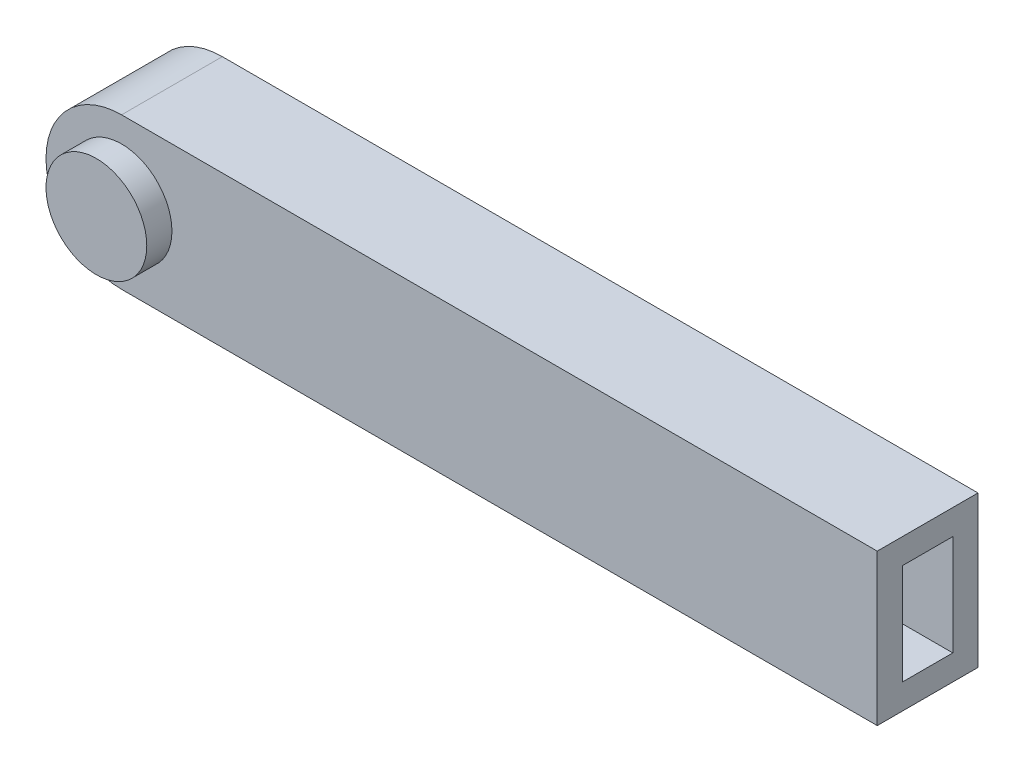
from build123d import *

# Parameters (mm, degrees)
BOSS_EXTRUDE1_DEPTH = 40
SHELL1_T            = -10
BOSS_EXTRUDE2_START = 10
SKETCH1_3_R         = 20
BOSS_EXTRUDE2_DEPTH = 10
SKETCH2_R           = 20
BOSS_EXTRUDE3_DEPTH = 10


with BuildPart() as part:
    # Sketch1 → Boss-Extrude1 (new body)
    with BuildSketch(Plane.XY):
        with BuildLine():
            Line((-300, 0), (0, 0))
            Line((0, 0), (0, 60))
            Line((0, 60), (-300, 60))
            ThreePointArc((-300, 60), (-330, 30), (-300, 0))
        make_face()
    extrude(amount=-BOSS_EXTRUDE1_DEPTH)

    # Shell1
    shell1_openings = [part.faces().sort_by_distance(p)[0] for p in [
        (0, 30, -20),
    ]]
    offset(amount=SHELL1_T, openings=shell1_openings, kind=Kind.INTERSECTION)

    # Sketch1<3> → Boss-Extrude2 (add)
    with BuildSketch(Plane.XY.offset(BOSS_EXTRUDE2_START)):
        with Locations((-300, 30)):
            Circle(SKETCH1_3_R)
    extrude(amount=-BOSS_EXTRUDE2_DEPTH)

    # Sketch2 → Boss-Extrude3 (add)
    with BuildSketch(Plane(origin=(0, 0, -40), x_dir=(-1, 0, 0), z_dir=(0, 0, -1))):
        with Locations((300, 30)):
            Circle(SKETCH2_R)
    extrude(amount=BOSS_EXTRUDE3_DEPTH)


solid = part.part
